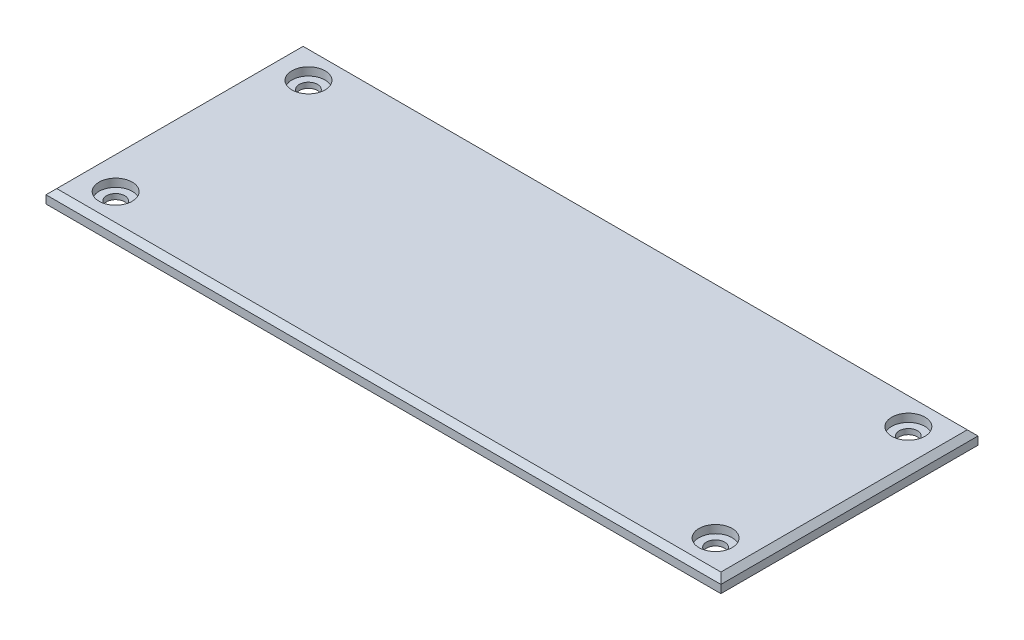
from build123d import *

# Parameters (mm, degrees)
SKETCH1_W           = 126
SKETCH1_H           = 48
BOSS_EXTRUDE1_DEPTH = 2.5
CHAMFER1_SIZE       = 1
SKETCH2_W           = 119.4
SKETCH2_H           = 41.4
SKETCH2_W_2         = 116.2
SKETCH2_H_2         = 38.2
BOSS_EXTRUDE2_DEPTH = 1.2
SKETCH3_R           = 4.5
CUT_EXTRUDE1_DEPTH  = 1.5
SKETCH4_R           = 1.7
CUT_EXTRUDE2_DEPTH  = 68.518071655
SKETCH5_R           = 3.1
CUT_EXTRUDE3_DEPTH  = 1.5


with BuildPart() as part:
    # Sketch1 → Boss-Extrude1 (new body)
    with BuildSketch(Plane(origin=(0, 25.5, 0), x_dir=(1, 0, 0), z_dir=(0, 1, 0))):
        Rectangle(SKETCH1_W, SKETCH1_H)
    extrude(amount=BOSS_EXTRUDE1_DEPTH)

    # Chamfer1
    chamfer1_edges = [part.edges().sort_by_distance(p)[0] for p in [
        (63, 28, 0),
        (0, 28, -24),
        (-63, 28, 0),
        (0, 28, 24),
    ]]
    chamfer(chamfer1_edges, length=CHAMFER1_SIZE)

    # Sketch2 → Boss-Extrude2 (add)
    with BuildSketch(Plane(origin=(0, 25.5, 0), x_dir=(1, 0, 0), z_dir=(0, 1, 0))):
        Rectangle(SKETCH2_W, SKETCH2_H)
        Rectangle(SKETCH2_W_2, SKETCH2_H_2, mode=Mode.SUBTRACT)
    extrude(amount=-BOSS_EXTRUDE2_DEPTH)

    # Sketch3 → Cut-Extrude1 (cut)
    with BuildSketch(Plane(origin=(0, 25.5, 0), x_dir=(1, 0, 0), z_dir=(0, 1, 0))):
        with Locations((-56, 18)):
            Circle(SKETCH3_R)
        with Locations((-56, -18)):
            Circle(SKETCH3_R)
        with Locations((56, 18)):
            Circle(SKETCH3_R)
        with Locations((56, -18)):
            Circle(SKETCH3_R)
    extrude(amount=-CUT_EXTRUDE1_DEPTH, mode=Mode.SUBTRACT)

    # Sketch4 → Cut-Extrude2 (cut, through all)
    with BuildSketch(Plane(origin=(0, 28, 0), x_dir=(1, 0, 0), z_dir=(0, 1, 0))):
        with Locations(Location((-56, 18, 0), (0, 0, 270))):
            Circle(SKETCH4_R)
        with Locations(Location((-56, -18, 0), (0, 0, 270))):
            Circle(SKETCH4_R)
        with Locations(Location((56, 18, 0), (0, 0, 270))):
            Circle(SKETCH4_R)
        with Locations(Location((56, -18, 0), (0, 0, 270))):
            Circle(SKETCH4_R)
    extrude(amount=-CUT_EXTRUDE2_DEPTH, mode=Mode.SUBTRACT)

    # Sketch5 → Cut-Extrude3 (cut)
    with BuildSketch(Plane(origin=(0, 28, 0), x_dir=(1, 0, 0), z_dir=(0, 1, 0))):
        with Locations(Location((-56, 18, 0), (0, 0, 270))):
            Circle(SKETCH5_R)
        with Locations(Location((-56, -18, 0), (0, 0, 270))):
            Circle(SKETCH5_R)
        with Locations(Location((56, 18, 0), (0, 0, 270))):
            Circle(SKETCH5_R)
        with Locations(Location((56, -18, 0), (0, 0, 270))):
            Circle(SKETCH5_R)
    extrude(amount=-CUT_EXTRUDE3_DEPTH, mode=Mode.SUBTRACT)


solid = part.part
